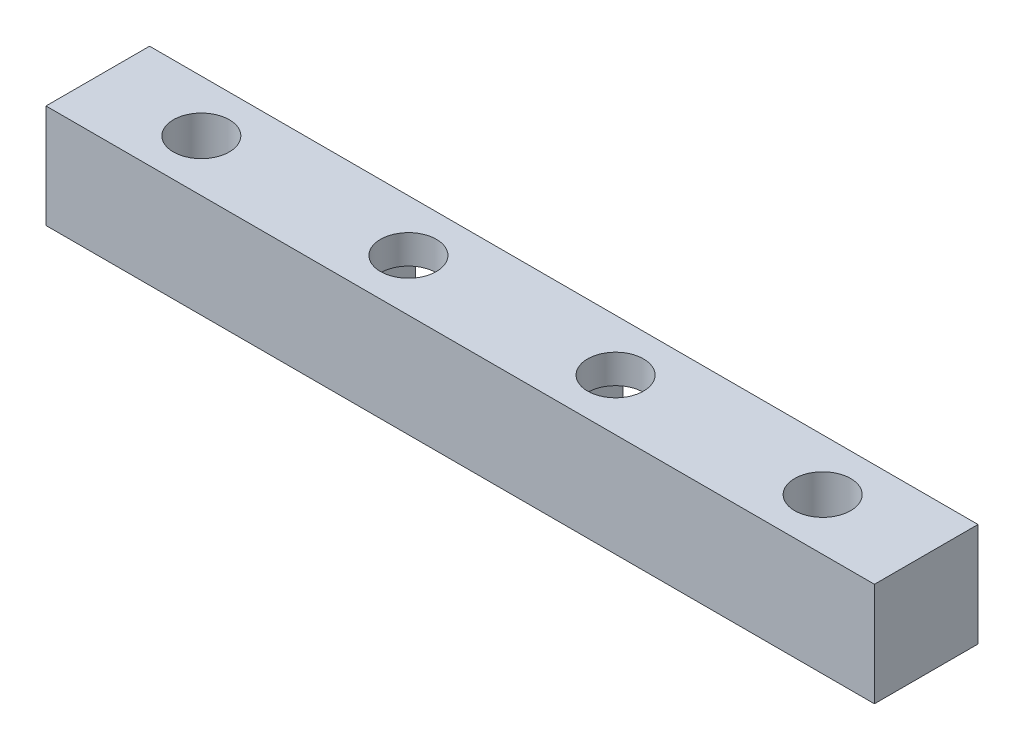
from build123d import *

# Parameters (mm, degrees)
SKETCH1_W           = 101.6
SKETCH1_H           = 12.7
BOSS_EXTRUDE1_DEPTH = 12.7
SKETCH2_R           = 3.429
CUT_EXTRUDE1_DEPTH  = 54.881536726
CUT_EXTRUDE2_DEPTH  = 2.794


with BuildPart() as part:
    # Sketch1 → Boss-Extrude1 (new body)
    with BuildSketch(Plane(origin=(0, 0, 0), x_dir=(1, 0, 0), z_dir=(0, 1, 0))):
        with Locations((0, 6.35)):
            Rectangle(SKETCH1_W, SKETCH1_H)
    extrude(amount=BOSS_EXTRUDE1_DEPTH)

    # Sketch2 → Cut-Extrude1 (cut, through all)
    with BuildSketch(Plane(origin=(0, 12.7, 0), x_dir=(1, 0, 0), z_dir=(0, 1, 0))):
        with Locations(Location((-38.1, 6.35, 0), (0, 0, 270))):
            Circle(SKETCH2_R)
        with Locations(Location((38.1, 6.35, 0), (0, 0, 270))):
            Circle(SKETCH2_R)
        with Locations(Location((-12.7, 6.35, 0), (0, 0, 270))):
            Circle(SKETCH2_R)
        with Locations(Location((12.7, 6.35, 0), (0, 0, 270))):
            Circle(SKETCH2_R)
    extrude(amount=-CUT_EXTRUDE1_DEPTH, mode=Mode.SUBTRACT)

    # Sketch3 → Cut-Extrude2 (cut, symmetric)
    with BuildSketch(Plane(origin=(0, 6.35, 0), x_dir=(1, 0, 0), z_dir=(0, 1, 0))):
        Polygon((-18.161, 3.19709018), (-18.161, 19.396139053), (-7.239, 19.396139053), (-7.239, 9.50290982), (-7.239, 3.19709018), (-12.7, 0.04418036), align=None)
        Polygon((7.239, 19.396139053), (18.161, 19.396139053), (18.161, 9.50290982), (18.161, 3.19709018), (12.7, 0.04418036), (7.239, 3.19709018), align=None)
    extrude(amount=CUT_EXTRUDE2_DEPTH, both=True, mode=Mode.SUBTRACT)


solid = part.part
